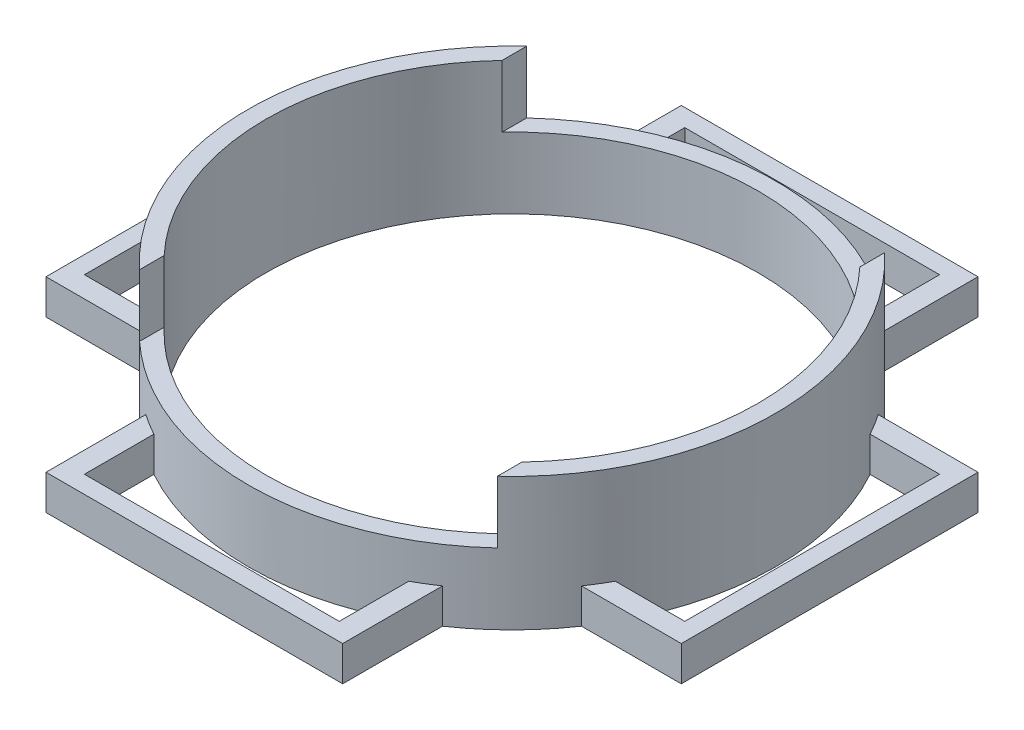
from build123d import *

# Parameters (mm, degrees)
CROQUIS1_W                 = 1
CROQUIS1_H                 = 7.62
SALIENTE_EXTRUIR1_START    = -3.81
SALIENTE_EXTRUIR1_DEPTH    = 2
MATRIZC1_COUNT             = 4
CORTAR_EXTRUIR1_DEPTH      = 27.019148718
CORTAR_EXTRUIR1_DEPTH_BACK = 27.019148718
CROQUIS4_W                 = 20.5
CROQUIS4_H                 = 3.56


with BuildPart() as part:
    # Croquis1 → Revolución1 (revolve)
    with BuildSketch(Plane.XY, mode=Mode.PRIVATE) as revoluci_n1_sk:
        with Locations((14.6, 0)):
            Rectangle(CROQUIS1_W, CROQUIS1_H)
    revolve(revoluci_n1_sk.sketch.rotate(Axis((0, 5.941666667, 0), (0, -1, 0)), 90), axis=Axis((0, 5.941666667, 0), (0, -1, 0)))

    # Croquis2 → Saliente-Extruir1 (add)
    with BuildSketch(Plane(origin=(0, 0, 0), x_dir=(1, 0, 0), z_dir=(0, 1, 0)).offset(SALIENTE_EXTRUIR1_START)):
        Polygon((8.5, -18.2), (-8.5, -18.2), (-8.5, -12.480384609), (-7.3, -12.480384609), (-7.3, -17.2), (7.3, -17.2), (7.3, -12.480384609), (8.5, -12.480384609), align=None)
    saliente_extruir1 = extrude(amount=SALIENTE_EXTRUIR1_DEPTH)

    # MatrizC1: Saliente-Extruir1 ×4 about axis
    matrizc1_axis = Axis((0, 0, 0), (0, 1, 0))
    for i in range(1, MATRIZC1_COUNT):
        add(saliente_extruir1.rotate(matrizc1_axis, i * 360 / MATRIZC1_COUNT))

    # Croquis4 → Cortar-Extruir1 (cut, two sides: drawn at the far end of the back side and taken through both)
    with BuildSketch(Plane.XY.offset(-CORTAR_EXTRUIR1_DEPTH_BACK)):
        with Locations((0, 2.03)):
            Rectangle(CROQUIS4_W, CROQUIS4_H)
    extrude(amount=CORTAR_EXTRUIR1_DEPTH + CORTAR_EXTRUIR1_DEPTH_BACK, mode=Mode.SUBTRACT)


solid = part.part
